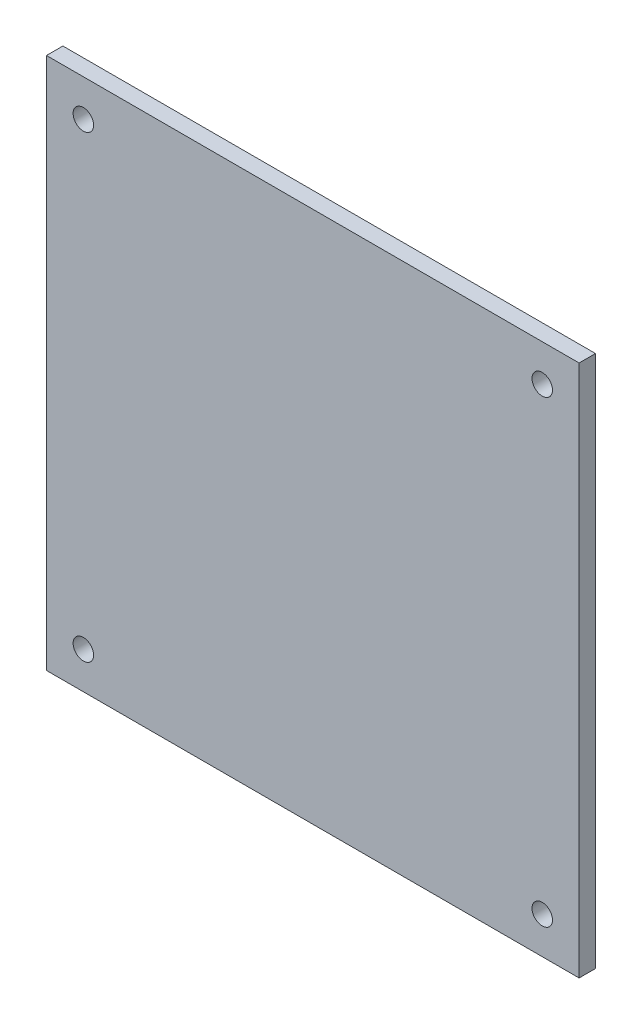
from build123d import *

# Parameters (mm, degrees)
BOSS_EXTRUDE1_DEPTH         = 2
BOSS_EXTRUDE1_DEPTH_BACK    = 2
SKETCH1_W                   = 130
SKETCH1_H                   = 130
TAP_DRILL_FOR_M5X0_8_TAP1_D = 5


with BuildPart() as part:
    # Sketch1 → Boss-Extrude1 (new, two sides: drawn at the far end of the back side and taken through both)
    with BuildSketch(Plane.XY.offset(-BOSS_EXTRUDE1_DEPTH_BACK)):
        Rectangle(SKETCH1_W, SKETCH1_H)
    extrude(amount=BOSS_EXTRUDE1_DEPTH + BOSS_EXTRUDE1_DEPTH_BACK)

    # Tap Drill for M5x0.8 Tap1 (through all)
    with Locations(Plane(origin=(0, 0, -2), x_dir=(-1, 0, 0), z_dir=(0, 0, -1))):
        with Locations((-56, 56), (56, 56), (56, -56), (-56, -56)):
            Hole(TAP_DRILL_FOR_M5X0_8_TAP1_D / 2)


solid = part.part
